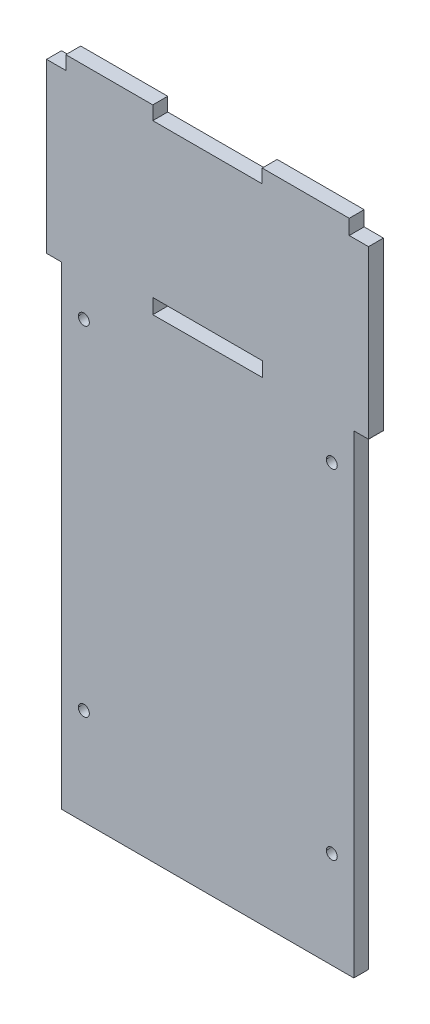
from build123d import *

# Parameters (mm, degrees)
BOSS_EXTRUDE1_DEPTH = 4.5


with BuildPart() as part:
    # Model → Boss-Extrude1 (new body)
    with BuildSketch(Plane.XY):
        Polygon((1244.858374133, -975.629345589), (1244.858374133, -1118.40581472), (1156.723196377, -1118.40581472), (1156.723196377, -975.629345589), (1152.29071999, -975.629345589), (1152.29071999, -975.556990867), (1152.29071999, -950.670988096), (1152.29071999, -925.729211157), (1152.29071999, -924.998820047), (1158.083648599, -924.998820047), (1158.083648599, -920.879186992), (1184.295672482, -920.879186992), (1184.295672482, -924.998820047), (1217.264872473, -924.998820047), (1217.264872473, -920.879186992), (1243.476896356, -920.879186992), (1243.476896356, -925.37643338), (1249.290144965, -925.37643338), (1249.290144965, -952.082099206), (1249.290144965, -975.556990867), (1249.290850521, -975.629345589), align=None)
        Polygon((1184.296342759, -971.129347535), (1184.296342759, -975.629345589), (1217.285227751, -975.502557256), (1217.285227751, -971.129347535), align=None, mode=Mode.SUBTRACT)
        with BuildLine():
            add(Edge.make_bspline(
                [(1239.873341912, -1089.255822228), (1239.873341912, -1090.167047227), (1239.134695801, -1090.905693338), (1238.223118024, -1090.905693338), (1237.312245802, -1090.905693338), (1236.572929413, -1090.167047227), (1236.572929413, -1089.255822228)],
                knots=[2, 2, 2, 2, 3, 3, 3, 4, 4, 4, 4], degree=3))
            add(Edge.make_bspline(
                [(1236.572929413, -1089.255822228), (1236.572929413, -1088.344597228), (1237.312245802, -1087.605633617), (1238.223118024, -1087.605633617), (1239.134695801, -1087.605633617), (1239.873341912, -1088.344597228), (1239.873341912, -1089.255822228)],
                knots=[0, 0, 0, 0, 1, 1, 1, 2, 2, 2, 2], degree=3))
        make_face(mode=Mode.SUBTRACT)
        with BuildLine():
            add(Edge.make_bspline(
                [(1165.173317764, -1089.255822228), (1165.173317764, -1090.167047227), (1164.434706931, -1090.905693338), (1163.523129154, -1090.905693338), (1162.612256932, -1090.905693338), (1161.872905265, -1090.167047227), (1161.872905265, -1089.255822228)],
                knots=[2, 2, 2, 2, 3, 3, 3, 4, 4, 4, 4], degree=3))
            add(Edge.make_bspline(
                [(1161.872905265, -1089.255822228), (1161.872905265, -1088.344597228), (1162.612256932, -1087.605633617), (1163.523129154, -1087.605633617), (1164.434706931, -1087.605633617), (1165.173317764, -1088.344597228), (1165.173317764, -1089.255822228)],
                knots=[0, 0, 0, 0, 1, 1, 1, 2, 2, 2, 2], degree=3))
        make_face(mode=Mode.SUBTRACT)
        with BuildLine():
            add(Edge.make_bspline(
                [(1239.873341912, -987.207618087), (1239.873341912, -988.119195864), (1239.134695801, -988.857806697), (1238.223118024, -988.857806697), (1237.312245802, -988.857806697), (1236.572929413, -988.119195864), (1236.572929413, -987.207618087)],
                knots=[2, 2, 2, 2, 3, 3, 3, 4, 4, 4, 4], degree=3))
            add(Edge.make_bspline(
                [(1236.572929413, -987.207618087), (1236.572929413, -986.296745865), (1237.312245802, -985.557746976), (1238.223118024, -985.557746976), (1239.134695801, -985.557746976), (1239.873341912, -986.296745865), (1239.873341912, -987.207618087)],
                knots=[0, 0, 0, 0, 1, 1, 1, 2, 2, 2, 2], degree=3))
        make_face(mode=Mode.SUBTRACT)
        with BuildLine():
            add(Edge.make_bspline(
                [(1165.172964986, -987.207618087), (1165.172964986, -988.119195864), (1164.434354153, -988.857806697), (1163.522776376, -988.857806697), (1162.611904154, -988.857806697), (1161.872587765, -988.119195864), (1161.872587765, -987.207618087)],
                knots=[2, 2, 2, 2, 3, 3, 3, 4, 4, 4, 4], degree=3))
            add(Edge.make_bspline(
                [(1161.872587765, -987.207618087), (1161.872587765, -986.296745865), (1162.611904154, -985.557746976), (1163.522776376, -985.557746976), (1164.434354153, -985.557746976), (1165.172964986, -986.296745865), (1165.172964986, -987.207618087)],
                knots=[0, 0, 0, 0, 1, 1, 1, 2, 2, 2, 2], degree=3))
        make_face(mode=Mode.SUBTRACT)
    extrude(amount=BOSS_EXTRUDE1_DEPTH)


solid = part.part
